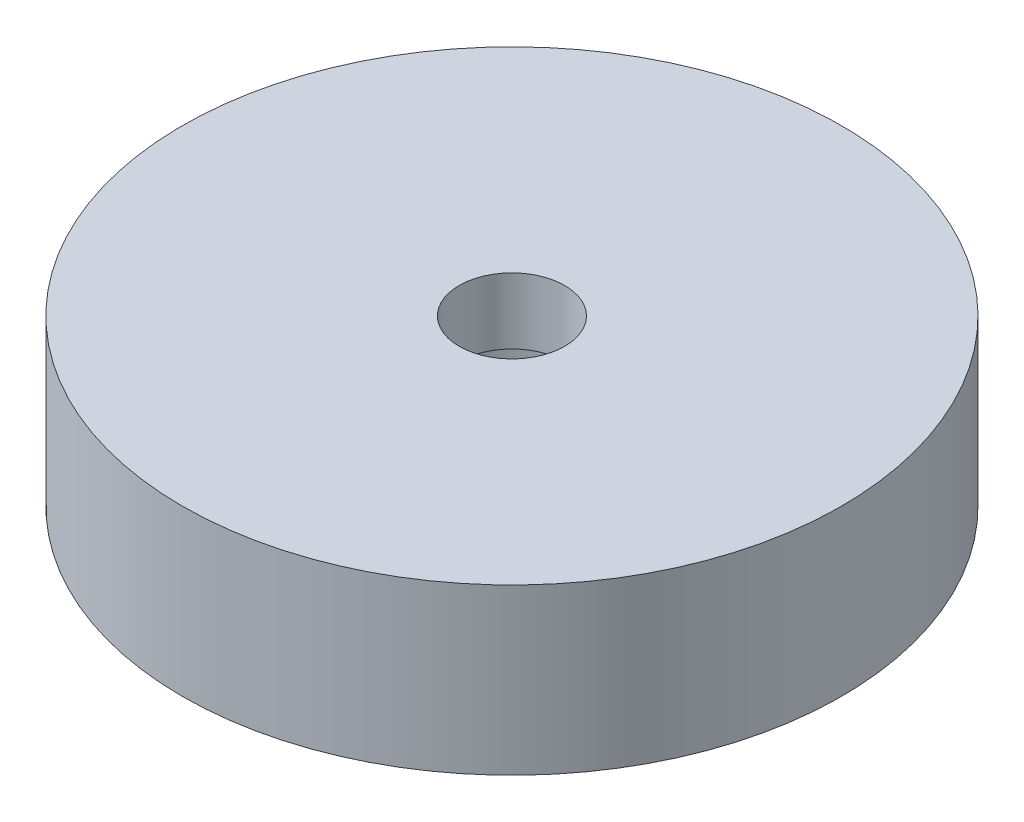
from build123d import *

# Parameters (mm, degrees)
SKETCH1_R           = 10
BOSS_EXTRUDE1_DEPTH = 5
CUT_EXTRUDE1_START  = -2
SKETCH2_R           = 3
CUT_EXTRUDE1_DEPTH  = 5
SKETCH3_R           = 1.6
CUT_EXTRUDE2_DEPTH  = 16


with BuildPart() as part:
    # Sketch1 → Boss-Extrude1 (new body)
    with BuildSketch(Plane(origin=(0, 0, 0), x_dir=(1, 0, 0), z_dir=(0, 1, 0))):
        with Locations(Location((0, 0, 0), (0, 0, 270))):
            Circle(SKETCH1_R)
    extrude(amount=BOSS_EXTRUDE1_DEPTH)

    # Sketch2 → Cut-Extrude1 (cut)
    with BuildSketch(Plane(origin=(0, 5, 0), x_dir=(1, 0, 0), z_dir=(0, 1, 0)).offset(CUT_EXTRUDE1_START)):
        with Locations(Location((0, 0, 0), (0, 0, 270))):
            Circle(SKETCH2_R)
    extrude(amount=-CUT_EXTRUDE1_DEPTH, mode=Mode.SUBTRACT)

    # Sketch3 → Cut-Extrude2 (cut, through all)
    with BuildSketch(Plane(origin=(0, 5, 0), x_dir=(1, 0, 0), z_dir=(0, 1, 0))):
        with Locations(Location((0, 0, 0), (0, 0, 270))):
            Circle(SKETCH3_R)
    extrude(amount=-CUT_EXTRUDE2_DEPTH, mode=Mode.SUBTRACT)


solid = part.part
